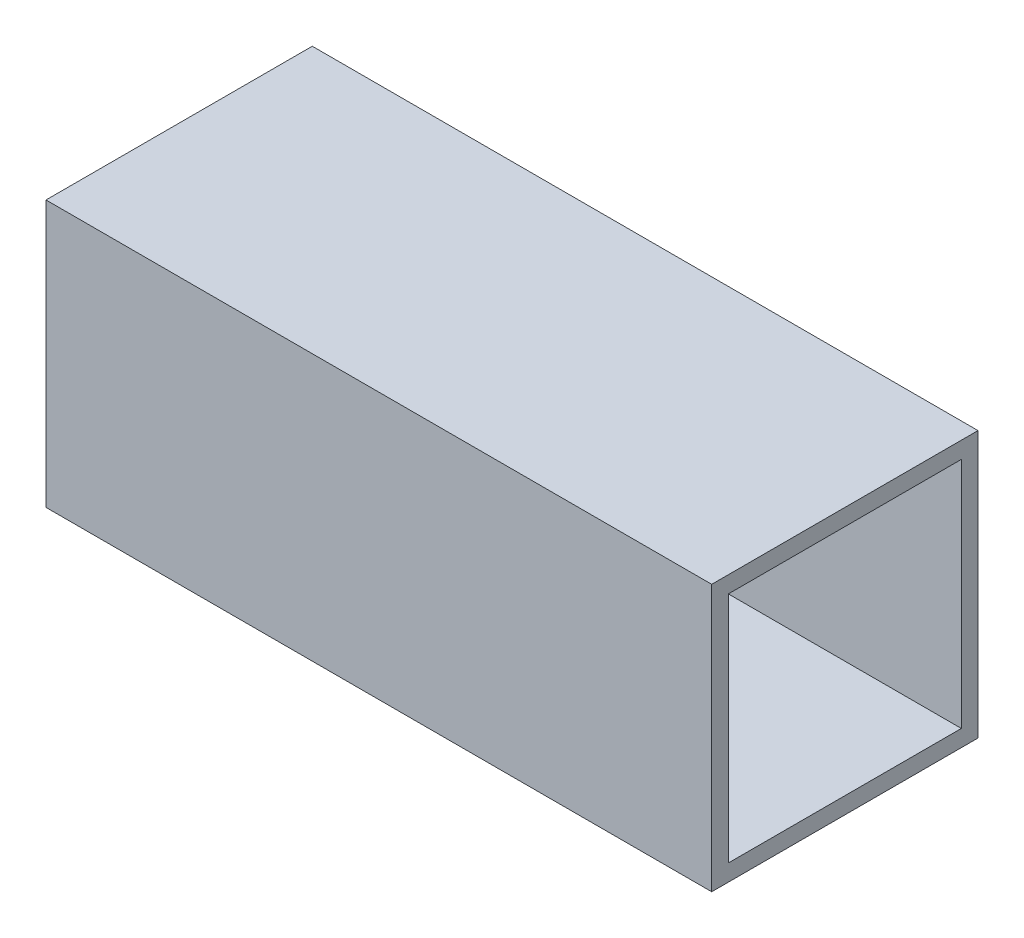
from build123d import *

# Parameters (mm, degrees)
SKETCH2_W           = 40
SKETCH2_H           = 40
BOSS_EXTRUDE1_DEPTH = 100
SHELL1_T            = -2.5
SKETCH3_R           = 6
CUT_EXTRUDE1_DEPTH  = 2.5


with BuildPart() as part:
    # Sketch2 → Boss-Extrude1 (new body)
    with BuildSketch(Plane(origin=(0, 0, 0), x_dir=(0, 0, -1), z_dir=(1, 0, 0))):
        with Locations((20, 20)):
            Rectangle(SKETCH2_W, SKETCH2_H)
    extrude(amount=BOSS_EXTRUDE1_DEPTH)

    # Shell1
    shell1_openings = [part.faces().sort_by_distance(p)[0] for p in [
        (100, 20, -20),
        (0, 20, -20),
    ]]
    offset(amount=SHELL1_T, openings=shell1_openings, kind=Kind.INTERSECTION)

    # Sketch3 → Cut-Extrude1 (cut)
    with BuildSketch(Plane(origin=(0, 0, -40), x_dir=(-1, 0, 0), z_dir=(0, 0, -1))):
        with Locations((-50, 20)):
            Circle(SKETCH3_R)
    extrude(amount=-CUT_EXTRUDE1_DEPTH, mode=Mode.SUBTRACT)


solid = part.part
